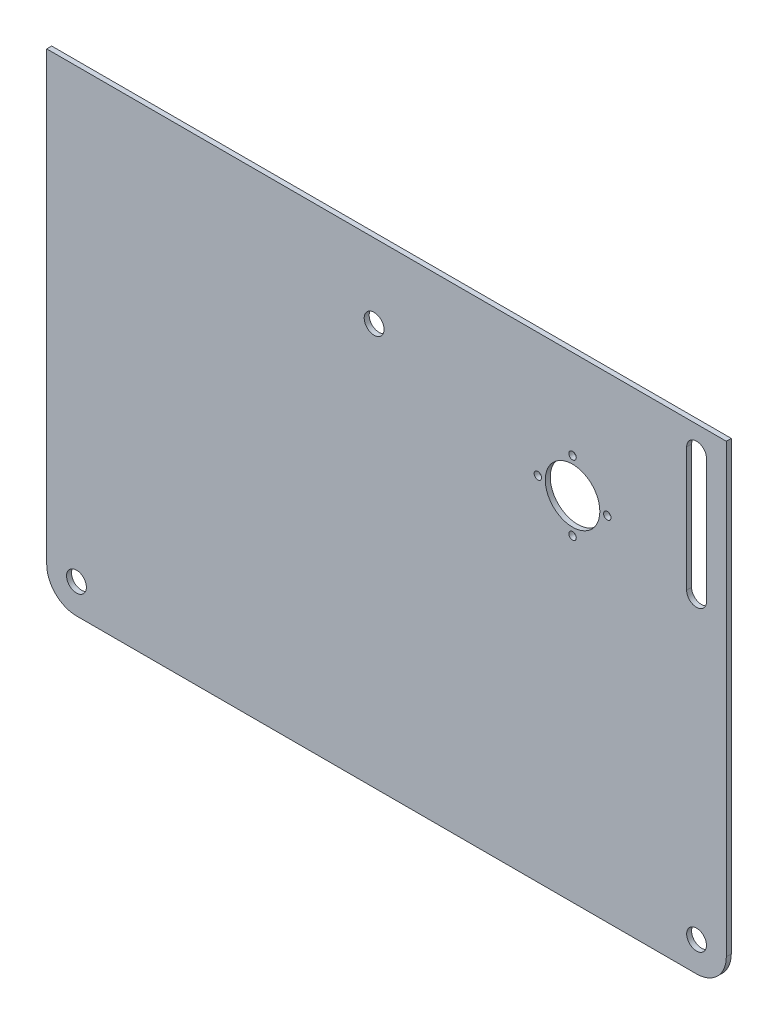
from build123d import *

# Parameters (mm, degrees)
SKETCH1_R           = 4
SKETCH1_R_2         = 1.5
SKETCH1_R_3         = 11
BOSS_EXTRUDE1_DEPTH = 2


with BuildPart() as part:
    # Sketch1 → Boss-Extrude1 (new body)
    with BuildSketch(Plane.XY):
        with BuildLine():
            ThreePointArc((-137, 0), (-133.485281374, -8.485281374), (-125, -12))
            Line((-125, -12), (125, -12))
            ThreePointArc((125, -12), (133.485281374, -8.485281374), (137, 0))
            Line((137, 0), (137, 180))
            Line((137, 180), (-53.998245329, 180))
            Line((-53.998245329, 180), (-137, 180))
            Line((-137, 180), (-137, 0))
        make_face()
        with Locations((-125, 0)):
            Circle(SKETCH1_R, mode=Mode.SUBTRACT)
        with Locations((125, 0)):
            Circle(SKETCH1_R, mode=Mode.SUBTRACT)
        with Locations((-5, 150)):
            Circle(SKETCH1_R, mode=Mode.SUBTRACT)
        with Locations((61, 130)):
            Circle(SKETCH1_R_2, mode=Mode.SUBTRACT)
        with Locations((75, 116)):
            Circle(SKETCH1_R_2, mode=Mode.SUBTRACT)
        with Locations((75, 130)):
            Circle(SKETCH1_R_3, mode=Mode.SUBTRACT)
        with Locations((89, 130)):
            Circle(SKETCH1_R_2, mode=Mode.SUBTRACT)
        with Locations((75, 144)):
            Circle(SKETCH1_R_2, mode=Mode.SUBTRACT)
        with BuildLine():
            ThreePointArc((129, 120), (125, 116), (121, 120))
            Line((121, 120), (121, 170))
            ThreePointArc((121, 170), (125, 174), (129, 170))
            Line((129, 170), (129, 120))
        make_face(mode=Mode.SUBTRACT)
    extrude(amount=BOSS_EXTRUDE1_DEPTH)


solid = part.part
